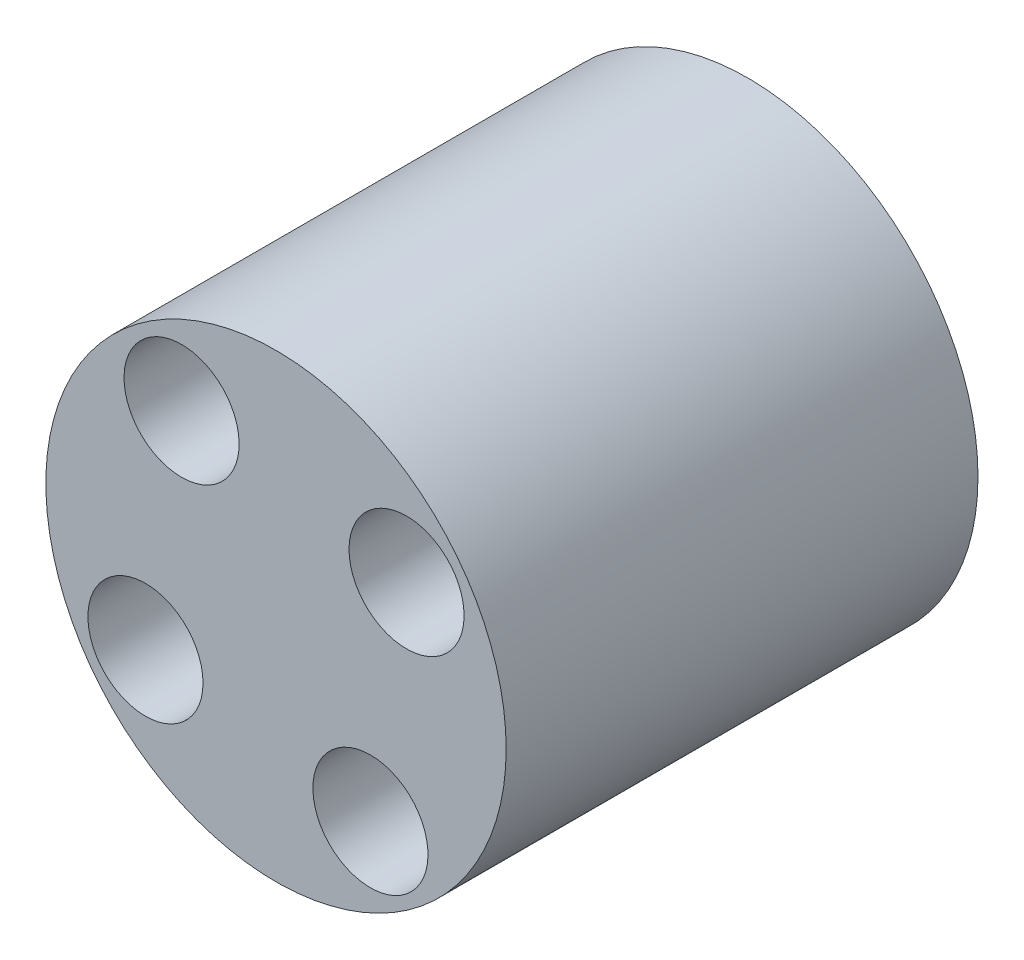
from build123d import *

# Parameters (mm, degrees)
SKETCH2_R           = 20
BOSS_EXTRUDE1_DEPTH = 35
SKETCH5_R           = 20
BOSS_EXTRUDE4_DEPTH = 6
SKETCH6_R           = 5
CUT_EXTRUDE1_DEPTH  = 50.809637622
CIRPATTERN2_COUNT   = 4


with BuildPart() as part:
    # Sketch2 → Boss-Extrude1 (new body)
    with BuildSketch(Plane.XY):
        Circle(SKETCH2_R)
    extrude(amount=BOSS_EXTRUDE1_DEPTH)

    # Sketch5 → Boss-Extrude4 (add)
    with BuildSketch(Plane.XY.offset(35)):
        Circle(SKETCH5_R)
    extrude(amount=BOSS_EXTRUDE4_DEPTH)

    # Sketch6 → Cut-Extrude1 (cut, through all)
    with BuildSketch(Plane(origin=(0, 0, 0), x_dir=(-1, 0, 0), z_dir=(0, 0, -1))):
        with Locations((-11.343432643, 8.205274881)):
            Circle(SKETCH6_R)
    cut_extrude1 = extrude(amount=-CUT_EXTRUDE1_DEPTH, mode=Mode.SUBTRACT)

    # CirPattern2: Cut-Extrude1 ×4 about axis
    cirpattern2_axis = Axis((0, 0, 0), (0, 0, 1))
    for i in range(1, CIRPATTERN2_COUNT):
        add(cut_extrude1.rotate(cirpattern2_axis, i * 360 / CIRPATTERN2_COUNT), mode=Mode.SUBTRACT)


solid = part.part
